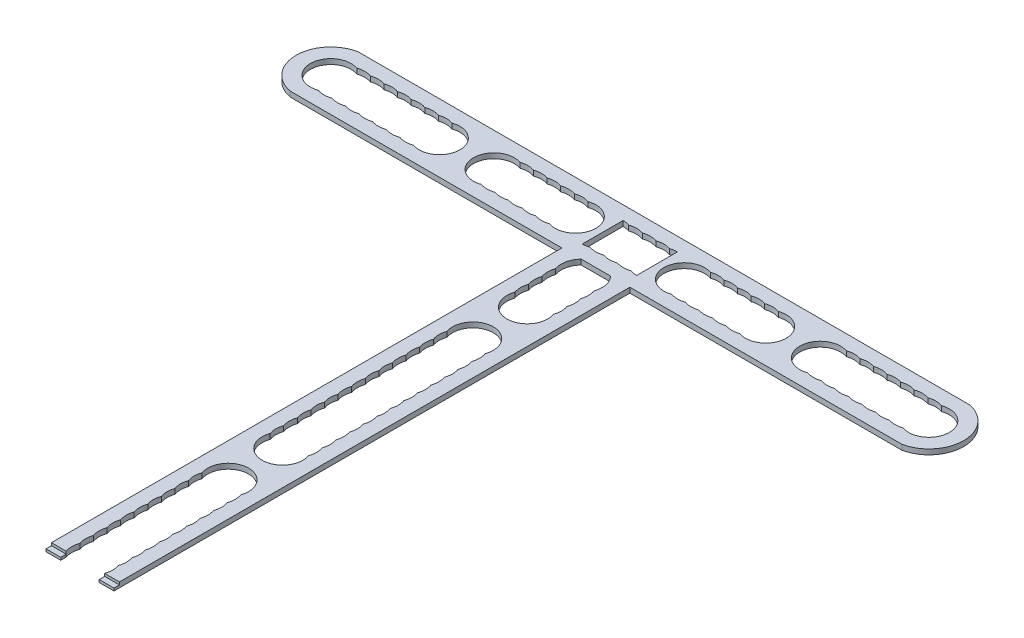
from build123d import *
from build123d.topology import SkipClean

# Parameters (mm, degrees)
BOSS_EXTRUDE1_DEPTH = 1.9
BOSS_EXTRUDE2_DEPTH = 1.9
SKETCH5_W           = 5.428932188
SKETCH5_H           = 2
BOSS_EXTRUDE3_DEPTH = 0.95


with BuildPart() as part:
    # Sketch3 → Boss-Extrude1 (new body)
    with BuildSketch(Plane(origin=(0, 0, 0), x_dir=(1, 0, 0), z_dir=(0, 1, 0))):
        with BuildLine():
            Line((0, -7.5), (0, -12.5))
            Line((0, -12.5), (112.5, -12.5))
            ThreePointArc((112.5, -12.5), (122.747548784, 0), (112.5, 12.5))
            Line((112.5, 12.5), (0, 12.5))
            Line((0, 12.5), (0, 7.5))
            ThreePointArc((0, 7.5), (1.26826484, 7.391989197), (2.5, 7.071067812))
            ThreePointArc((2.5, 7.071067812), (5, 7.5), (7.5, 7.071067812))
            ThreePointArc((7.5, 7.071067812), (8.73173516, 7.391989197), (10, 7.5))
            Line((10, 7.5), (10, -7.5))
            ThreePointArc((10, -7.5), (8.73173516, -7.391989197), (7.5, -7.071067812))
            ThreePointArc((7.5, -7.071067812), (5, -7.5), (2.5, -7.071067812))
            ThreePointArc((2.5, -7.071067812), (1.26826484, -7.391989197), (0, -7.5))
        make_face()
        with BuildLine():
            ThreePointArc((22.5, 7.071067812), (25, 7.5), (27.5, 7.071067812))
            ThreePointArc((27.5, 7.071067812), (30, 7.5), (32.5, 7.071067812))
            ThreePointArc((32.5, 7.071067812), (35, 7.5), (37.5, 7.071067812))
            ThreePointArc((37.5, 7.071067812), (40, 7.5), (42.5, 7.071067812))
            ThreePointArc((42.5, 7.071067812), (45, 7.5), (47.5, 7.071067812))
            ThreePointArc((47.5, 7.071067812), (57.5, 0), (47.5, -7.071067812))
            ThreePointArc((47.5, -7.071067812), (45, -7.5), (42.5, -7.071067812))
            ThreePointArc((42.5, -7.071067812), (40, -7.5), (37.5, -7.071067812))
            ThreePointArc((37.5, -7.071067812), (35, -7.5), (32.5, -7.071067812))
            ThreePointArc((32.5, -7.071067812), (30, -7.5), (27.5, -7.071067812))
            ThreePointArc((27.5, -7.071067812), (25, -7.5), (22.5, -7.071067812))
            ThreePointArc((22.5, -7.071067812), (12.5, 0), (22.5, 7.071067812))
        make_face(mode=Mode.SUBTRACT)
        with BuildLine():
            ThreePointArc((72.5, 7.071067812), (75, 7.5), (77.5, 7.071067812))
            ThreePointArc((77.5, 7.071067812), (80, 7.5), (82.5, 7.071067812))
            ThreePointArc((82.5, 7.071067812), (85, 7.5), (87.5, 7.071067812))
            ThreePointArc((87.5, 7.071067812), (90, 7.5), (92.5, 7.071067812))
            ThreePointArc((92.5, 7.071067812), (95, 7.5), (97.5, 7.071067812))
            ThreePointArc((97.5, 7.071067812), (100, 7.5), (102.5, 7.071067812))
            ThreePointArc((102.5, 7.071067812), (105, 7.5), (107.5, 7.071067812))
            ThreePointArc((107.5, 7.071067812), (117.5, 0), (107.5, -7.071067812))
            ThreePointArc((107.5, -7.071067812), (105, -7.5), (102.5, -7.071067812))
            ThreePointArc((102.5, -7.071067812), (100, -7.5), (97.5, -7.071067812))
            ThreePointArc((97.5, -7.071067812), (95, -7.5), (92.5, -7.071067812))
            ThreePointArc((92.5, -7.071067812), (90, -7.5), (87.5, -7.071067812))
            ThreePointArc((87.5, -7.071067812), (85, -7.5), (82.5, -7.071067812))
            ThreePointArc((82.5, -7.071067812), (80, -7.5), (77.5, -7.071067812))
            ThreePointArc((77.5, -7.071067812), (75, -7.5), (72.5, -7.071067812))
            ThreePointArc((72.5, -7.071067812), (62.5, 0), (72.5, 7.071067812))
        make_face(mode=Mode.SUBTRACT)
    boss_extrude1 = extrude(amount=BOSS_EXTRUDE1_DEPTH)

    # Mirror1: Boss-Extrude1 across plane
    add(boss_extrude1.mirror(Plane(origin=(0, 0, 0), x_dir=(0, 0, 1), z_dir=(1, 0, 0))))

    # Sketch4 → Boss-Extrude2 (add)
    with SkipClean():  # the faces are left unmerged after this step: merging them gives an invalid solid
        with BuildSketch(Plane(origin=(0, 0, 0), x_dir=(1, 0, 0), z_dir=(0, 1, 0))):
            with BuildLine():
                Line((7.071067812, -200.214466094), (12.5, -200.214466094))
                Line((12.5, -200.214466094), (12.5, -12.5))
                Line((12.5, -12.5), (5.390671883, -12.5))
                ThreePointArc((5.390671883, -12.5), (6.376975819, -13.766785839), (7.071067812, -15.214466094))
                ThreePointArc((7.071067812, -15.214466094), (7.5, -17.714466094), (7.071067812, -20.214466094))
                ThreePointArc((7.071067812, -20.214466094), (7.5, -22.714466094), (7.071067812, -25.214466094))
                ThreePointArc((7.071067812, -25.214466094), (7.5, -27.714466094), (7.071067812, -30.214466094))
                ThreePointArc((7.071067812, -30.214466094), (7.5, -32.714466094), (7.071067812, -35.214466094))
                ThreePointArc((7.071067812, -35.214466094), (7.5, -37.714466094), (7.071067812, -40.214466094))
                ThreePointArc((7.071067812, -40.214466094), (7.5, -42.714466094), (7.071067812, -45.214466094))
                ThreePointArc((7.071067812, -45.214466094), (7.5, -47.714466094), (7.071067812, -50.214466094))
                ThreePointArc((7.071067812, -50.214466094), (7.5, -52.714466094), (7.071067812, -55.214466094))
                ThreePointArc((7.071067812, -55.214466094), (7.5, -57.714466094), (7.071067812, -60.214466094))
                ThreePointArc((7.071067812, -60.214466094), (7.5, -62.714466094), (7.071067812, -65.214466094))
                ThreePointArc((7.071067812, -65.214466094), (7.5, -67.714466094), (7.071067812, -70.214466094))
                ThreePointArc((7.071067812, -70.214466094), (7.5, -72.714466094), (7.071067812, -75.214466094))
                ThreePointArc((7.071067812, -75.214466094), (7.5, -77.714466094), (7.071067812, -80.214466094))
                ThreePointArc((7.071067812, -80.214466094), (7.5, -82.714466094), (7.071067812, -85.214466094))
                ThreePointArc((7.071067812, -85.214466094), (7.5, -87.714466094), (7.071067812, -90.214466094))
                ThreePointArc((7.071067812, -90.214466094), (7.5, -92.714466094), (7.071067812, -95.214466094))
                ThreePointArc((7.071067812, -95.214466094), (7.5, -97.714466094), (7.071067812, -100.214466094))
                ThreePointArc((7.071067812, -100.214466094), (7.5, -102.714466094), (7.071067812, -105.214466094))
                ThreePointArc((7.071067812, -105.214466094), (7.5, -107.714466094), (7.071067812, -110.214466094))
                ThreePointArc((7.071067812, -110.214466094), (7.5, -112.714466094), (7.071067812, -115.214466094))
                ThreePointArc((7.071067812, -115.214466094), (7.5, -117.714466094), (7.071067812, -120.214466094))
                ThreePointArc((7.071067812, -120.214466094), (7.5, -122.714466094), (7.071067812, -125.214466094))
                ThreePointArc((7.071067812, -125.214466094), (7.5, -127.714466094), (7.071067812, -130.214466094))
                ThreePointArc((7.071067812, -130.214466094), (7.5, -132.714466094), (7.071067812, -135.214466094))
                ThreePointArc((7.071067812, -135.214466094), (7.5, -137.714466094), (7.071067812, -140.214466094))
                ThreePointArc((7.071067812, -140.214466094), (7.5, -142.714466094), (7.071067812, -145.214466094))
                ThreePointArc((7.071067812, -145.214466094), (7.5, -147.714466094), (7.071067812, -150.214466094))
                ThreePointArc((7.071067812, -150.214466094), (7.5, -152.714466094), (7.071067812, -155.214466094))
                ThreePointArc((7.071067812, -155.214466094), (7.5, -157.714466094), (7.071067812, -160.214466094))
                ThreePointArc((7.071067812, -160.214466094), (7.5, -162.714466094), (7.071067812, -165.214466094))
                ThreePointArc((7.071067812, -165.214466094), (7.5, -167.714466094), (7.071067812, -170.214466094))
                ThreePointArc((7.071067812, -170.214466094), (7.5, -172.714466094), (7.071067812, -175.214466094))
                ThreePointArc((7.071067812, -175.214466094), (7.5, -177.714466094), (7.071067812, -180.214466094))
                ThreePointArc((7.071067812, -180.214466094), (7.5, -182.714466094), (7.071067812, -185.214466094))
                ThreePointArc((7.071067812, -185.214466094), (7.5, -187.714466094), (7.071067812, -190.214466094))
                ThreePointArc((7.071067812, -190.214466094), (7.5, -192.714466094), (7.071067812, -195.214466094))
                ThreePointArc((7.071067812, -195.214466094), (7.5, -197.714466094), (7.071067812, -200.214466094))
            make_face()
            with BuildLine():
                Line((-12.5, -12.5), (-12.5, -200.214466094))
                Line((-12.5, -200.214466094), (-7.071067812, -200.214466094))
                ThreePointArc((-7.071067812, -200.214466094), (-7.5, -197.714466094), (-7.071067812, -195.214466094))
                ThreePointArc((-7.071067812, -195.214466094), (-7.5, -192.714466094), (-7.071067812, -190.214466094))
                ThreePointArc((-7.071067812, -190.214466094), (-7.5, -187.714466094), (-7.071067812, -185.214466094))
                ThreePointArc((-7.071067812, -185.214466094), (-7.5, -182.714466094), (-7.071067812, -180.214466094))
                ThreePointArc((-7.071067812, -180.214466094), (-7.5, -177.714466094), (-7.071067812, -175.214466094))
                ThreePointArc((-7.071067812, -175.214466094), (-7.5, -172.714466094), (-7.071067812, -170.214466094))
                ThreePointArc((-7.071067812, -170.214466094), (-7.5, -167.714466094), (-7.071067812, -165.214466094))
                ThreePointArc((-7.071067812, -165.214466094), (-7.5, -162.714466094), (-7.071067812, -160.214466094))
                ThreePointArc((-7.071067812, -160.214466094), (-7.5, -157.714466094), (-7.071067812, -155.214466094))
                ThreePointArc((-7.071067812, -155.214466094), (-7.5, -152.714466094), (-7.071067812, -150.214466094))
                ThreePointArc((-7.071067812, -150.214466094), (-7.5, -147.714466094), (-7.071067812, -145.214466094))
                ThreePointArc((-7.071067812, -145.214466094), (-7.5, -142.714466094), (-7.071067812, -140.214466094))
                ThreePointArc((-7.071067812, -140.214466094), (-7.5, -137.714466094), (-7.071067812, -135.214466094))
                ThreePointArc((-7.071067812, -135.214466094), (-7.5, -132.714466094), (-7.071067812, -130.214466094))
                ThreePointArc((-7.071067812, -130.214466094), (-7.5, -127.714466094), (-7.071067812, -125.214466094))
                ThreePointArc((-7.071067812, -125.214466094), (-7.5, -122.714466094), (-7.071067812, -120.214466094))
                ThreePointArc((-7.071067812, -120.214466094), (-7.5, -117.714466094), (-7.071067812, -115.214466094))
                ThreePointArc((-7.071067812, -115.214466094), (-7.5, -112.714466094), (-7.071067812, -110.214466094))
                ThreePointArc((-7.071067812, -110.214466094), (-7.5, -107.714466094), (-7.071067812, -105.214466094))
                ThreePointArc((-7.071067812, -105.214466094), (-7.5, -102.714466094), (-7.071067812, -100.214466094))
                ThreePointArc((-7.071067812, -100.214466094), (-7.5, -97.714466094), (-7.071067812, -95.214466094))
                ThreePointArc((-7.071067812, -95.214466094), (-7.5, -92.714466094), (-7.071067812, -90.214466094))
                ThreePointArc((-7.071067812, -90.214466094), (-7.5, -87.714466094), (-7.071067812, -85.214466094))
                ThreePointArc((-7.071067812, -85.214466094), (-7.5, -82.714466094), (-7.071067812, -80.214466094))
                ThreePointArc((-7.071067812, -80.214466094), (-7.5, -77.714466094), (-7.071067812, -75.214466094))
                ThreePointArc((-7.071067812, -75.214466094), (-7.5, -72.714466094), (-7.071067812, -70.214466094))
                ThreePointArc((-7.071067812, -70.214466094), (-7.5, -67.714466094), (-7.071067812, -65.214466094))
                ThreePointArc((-7.071067812, -65.214466094), (-7.5, -62.714466094), (-7.071067812, -60.214466094))
                ThreePointArc((-7.071067812, -60.214466094), (-7.5, -57.714466094), (-7.071067812, -55.214466094))
                ThreePointArc((-7.071067812, -55.214466094), (-7.5, -52.714466094), (-7.071067812, -50.214466094))
                ThreePointArc((-7.071067812, -50.214466094), (-7.5, -47.714466094), (-7.071067812, -45.214466094))
                ThreePointArc((-7.071067812, -45.214466094), (-7.5, -42.714466094), (-7.071067812, -40.214466094))
                ThreePointArc((-7.071067812, -40.214466094), (-7.5, -37.714466094), (-7.071067812, -35.214466094))
                ThreePointArc((-7.071067812, -35.214466094), (-7.5, -32.714466094), (-7.071067812, -30.214466094))
                ThreePointArc((-7.071067812, -30.214466094), (-7.5, -27.714466094), (-7.071067812, -25.214466094))
                ThreePointArc((-7.071067812, -25.214466094), (-7.5, -22.714466094), (-7.071067812, -20.214466094))
                ThreePointArc((-7.071067812, -20.214466094), (-7.5, -17.714466094), (-7.071067812, -15.214466094))
                ThreePointArc((-7.071067812, -15.214466094), (-6.376975819, -13.766785839), (-5.390671883, -12.5))
                Line((-5.390671883, -12.5), (-12.5, -12.5))
            make_face()
            with BuildLine():
                ThreePointArc((7.071067812, -55.214466094), (0, -50.214466094), (-7.071067812, -55.214466094))
                ThreePointArc((-7.071067812, -55.214466094), (-7.5, -52.714466094), (-7.071067812, -50.214466094))
                ThreePointArc((-7.071067812, -50.214466094), (-7.5, -47.714466094), (-7.071067812, -45.214466094))
                ThreePointArc((-7.071067812, -45.214466094), (-7.5, -42.714466094), (-7.071067812, -40.214466094))
                ThreePointArc((-7.071067812, -40.214466094), (0, -45.214466094), (7.071067812, -40.214466094))
                ThreePointArc((7.071067812, -40.214466094), (7.5, -42.714466094), (7.071067812, -45.214466094))
                ThreePointArc((7.071067812, -45.214466094), (7.5, -47.714466094), (7.071067812, -50.214466094))
                ThreePointArc((7.071067812, -50.214466094), (7.5, -52.714466094), (7.071067812, -55.214466094))
            make_face()
            with BuildLine():
                ThreePointArc((7.071067812, -145.214466094), (0, -140.214466094), (-7.071067812, -145.214466094))
                ThreePointArc((-7.071067812, -145.214466094), (-7.5, -142.714466094), (-7.071067812, -140.214466094))
                ThreePointArc((-7.071067812, -140.214466094), (-7.5, -137.714466094), (-7.071067812, -135.214466094))
                ThreePointArc((-7.071067812, -135.214466094), (-7.5, -132.714466094), (-7.071067812, -130.214466094))
                ThreePointArc((-7.071067812, -130.214466094), (0, -135.214466094), (7.071067812, -130.214466094))
                ThreePointArc((7.071067812, -130.214466094), (7.5, -132.714466094), (7.071067812, -135.214466094))
                ThreePointArc((7.071067812, -135.214466094), (7.5, -137.714466094), (7.071067812, -140.214466094))
                ThreePointArc((7.071067812, -140.214466094), (7.5, -142.714466094), (7.071067812, -145.214466094))
            make_face()
        extrude(amount=BOSS_EXTRUDE2_DEPTH)

    # Sketch5 → Boss-Extrude3 (add)
    with SkipClean():  # the faces are left unmerged after this step: merging them gives an invalid solid
        with BuildSketch(Plane(origin=(0, 0, 0), x_dir=(1, 0, 0), z_dir=(0, 1, 0))):
            with Locations((-9.785533906, -201.214466094)):
                Rectangle(SKETCH5_W, SKETCH5_H)
            with Locations((9.785533906, -201.214466094)):
                Rectangle(SKETCH5_W, SKETCH5_H)
        extrude(amount=BOSS_EXTRUDE3_DEPTH)


solid = part.part
